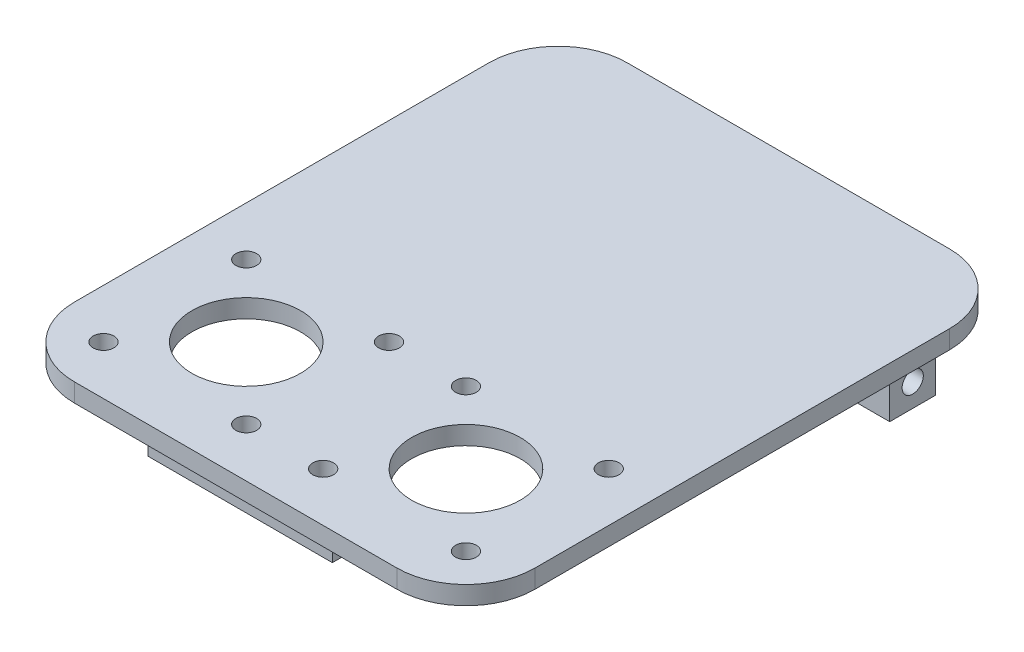
from build123d import *

# Parameters (mm, degrees)
SKETCH3_W            = 100
SKETCH3_H            = 120
BOSS_EXTRUDE3_DEPTH  = 4
M4_CLEARANCE_HOLE1_D = 4.5
SKETCH5_R            = 11.8
CUT_EXTRUDE3_DEPTH   = 79.204859184
FILLET1_R            = 15
SKETCH23_W           = 9
SKETCH23_H           = 10
BOSS_EXTRUDE5_DEPTH  = 10
SKETCH26_W           = 40
SKETCH26_H           = 2
BOSS_EXTRUDE6_DEPTH  = 3
SKETCH27_R           = 2.3
CUT_EXTRUDE4_DEPTH   = 6.6
CUT_EXTRUDE5_START   = -6.6
SKETCH28_R           = 2.3
CUT_EXTRUDE5_DEPTH   = 6.6
FILLET2_R            = 2
FILLET3_R            = 2
FILLET4_R            = 2
FILLET5_R            = 2
FILLET6_R            = 2
FILLET7_R            = 2


with BuildPart() as part:
    # Sketch3 → Boss-Extrude3 (new body)
    with BuildSketch(Plane(origin=(0, 0, 0), x_dir=(1, 0, 0), z_dir=(0, 1, 0))):
        Rectangle(SKETCH3_W, SKETCH3_H)
    extrude(amount=BOSS_EXTRUDE3_DEPTH)

    # M4 Clearance Hole1 (through all)
    with Locations(Plane(origin=(0, 4, 0), x_dir=(1, 0, 0), z_dir=(0, 1, 0))):
        with Locations((-8.35, -18.35), (-39.35, -18.35), (-39.35, -49.35), (-8.35, -49.35), (8.35, -18.35), (39.35, -18.35), (39.35, -49.35), (8.35, -49.35)):
            Hole(M4_CLEARANCE_HOLE1_D / 2)

    # Sketch5 → Cut-Extrude3 (cut, through all)
    with BuildSketch(Plane(origin=(0, 4, 0), x_dir=(1, 0, 0), z_dir=(0, 1, 0))):
        with Locations(Location((-23.85, -33.85, 0), (0, 0, 270))):
            Circle(SKETCH5_R)
        with Locations(Location((23.85, -33.85, 0), (0, 0, 270))):
            Circle(SKETCH5_R)
    extrude(amount=-CUT_EXTRUDE3_DEPTH, mode=Mode.SUBTRACT)

    # Fillet1
    fillet1_edges = [part.edges().sort_by_distance(p)[0] for p in [
        (50, 2, 60),
        (-50, 2, 60),
        (-50, 2, -60),
        (50, 2, -60),
    ]]
    fillet(fillet1_edges, radius=FILLET1_R)

    # Sketch23 → Boss-Extrude5 (add)
    with BuildSketch(Plane.XZ):
        with Locations((-42.5, -40)):
            Rectangle(SKETCH23_W, SKETCH23_H)
        with Locations((42.5, -40)):
            Rectangle(SKETCH23_W, SKETCH23_H)
    extrude(amount=BOSS_EXTRUDE5_DEPTH)

    # Sketch26 → Boss-Extrude6 (add)
    with BuildSketch(Plane.XZ):
        with Locations((0, 58)):
            Rectangle(SKETCH26_W, SKETCH26_H)
    extrude(amount=BOSS_EXTRUDE6_DEPTH)

    # Sketch27 → Cut-Extrude4 (cut)
    with BuildSketch(Plane.ZY.offset(47)):
        with Locations((-40, -5)):
            Circle(SKETCH27_R)
    extrude(amount=-CUT_EXTRUDE4_DEPTH, mode=Mode.SUBTRACT)

    # Sketch28 → Cut-Extrude5 (cut)
    with BuildSketch(Plane(origin=(47, 0, 0), x_dir=(0, 0, -1), z_dir=(1, 0, 0)).offset(CUT_EXTRUDE5_START)):
        with Locations(Location((40, -5, 0), (0, 0, 180))):
            Circle(SKETCH28_R)
    extrude(amount=CUT_EXTRUDE5_DEPTH, mode=Mode.SUBTRACT)

    # Fillet2
    fillet2_edges = [part.edges().sort_by_distance(p)[0] for p in [
        (38, 0, -40),
    ]]
    fillet(fillet2_edges, radius=FILLET2_R)

    # Fillet3
    fillet3_edges = [part.edges().sort_by_distance(p)[0] for p in [
        (-38, 0, -40),
    ]]
    fillet(fillet3_edges, radius=FILLET3_R)

    # Fillet4
    fillet4_edges = [part.edges().sort_by_distance(p)[0] for p in [
        (41.5, 0, -35),
    ]]
    fillet(fillet4_edges, radius=FILLET4_R)

    # Fillet5
    fillet5_edges = [part.edges().sort_by_distance(p)[0] for p in [
        (-41.5, 0, -35),
    ]]
    fillet(fillet5_edges, radius=FILLET5_R)

    # Fillet6
    fillet6_edges = [part.edges().sort_by_distance(p)[0] for p in [
        (41.5, 0, -45),
    ]]
    fillet(fillet6_edges, radius=FILLET6_R)

    # Fillet7
    fillet7_edges = [part.edges().sort_by_distance(p)[0] for p in [
        (-41.5, 0, -45),
    ]]
    fillet(fillet7_edges, radius=FILLET7_R)


solid = part.part
